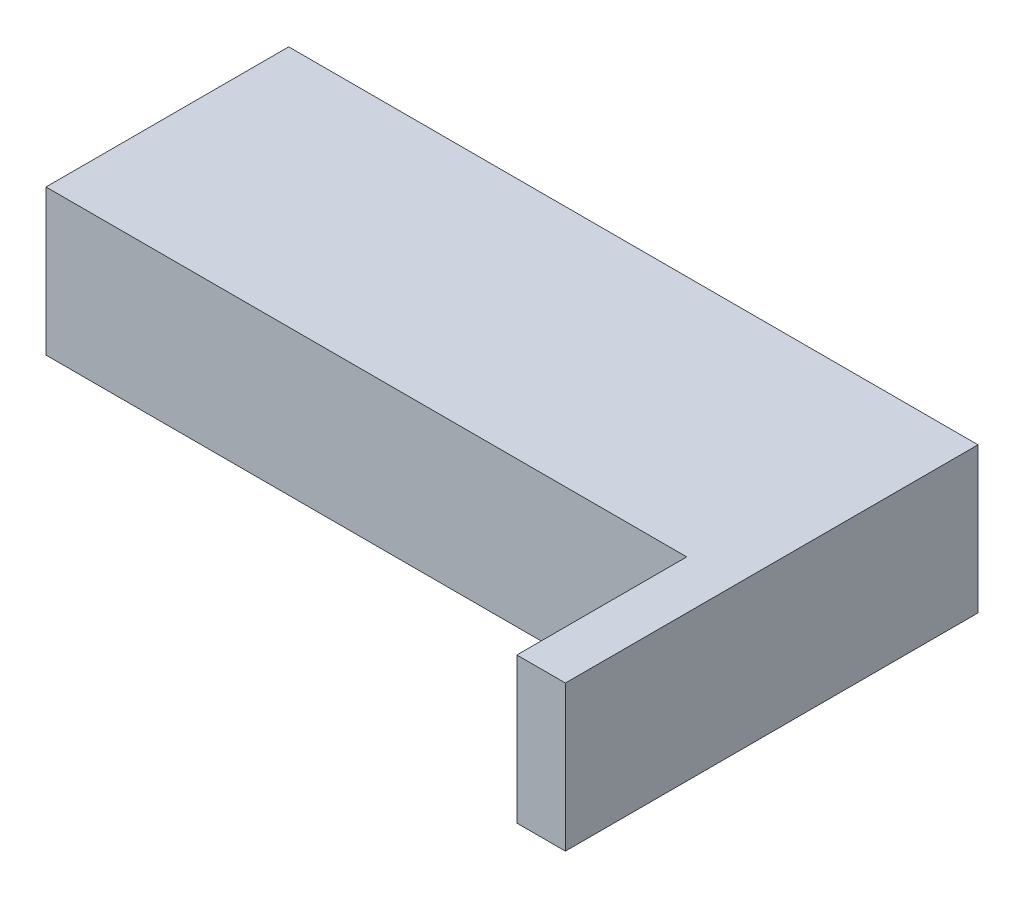
from build123d import *

# Parameters (mm, degrees)
SKETCH1_W           = 142
SKETCH1_H           = 50
BOSS_EXTRUDE1_DEPTH = 30
SKETCH2_W           = 10
SKETCH2_H           = 30
BOSS_EXTRUDE2_DEPTH = 35


with BuildPart() as part:
    # Sketch1 → Boss-Extrude1 (new body)
    with BuildSketch(Plane(origin=(0, 0, 0), x_dir=(1, 0, 0), z_dir=(0, 1, 0))):
        with Locations((71, 25)):
            Rectangle(SKETCH1_W, SKETCH1_H)
    extrude(amount=BOSS_EXTRUDE1_DEPTH)

    # Sketch2 → Boss-Extrude2 (add)
    with BuildSketch(Plane.XY):
        with Locations((137, 15)):
            Rectangle(SKETCH2_W, SKETCH2_H)
    extrude(amount=BOSS_EXTRUDE2_DEPTH)


solid = part.part
